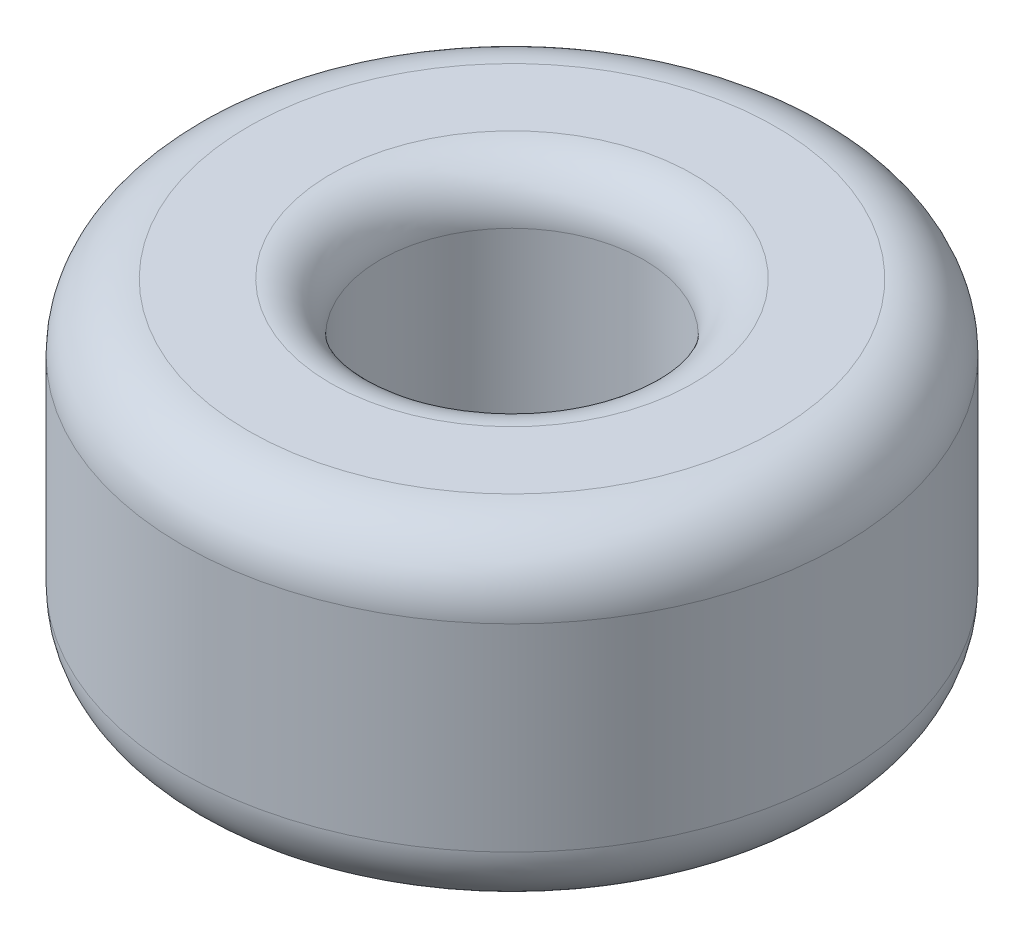
from build123d import *

# Parameters (mm, degrees)
CROQUIS1_R              = 50
CROQUIS1_R_2            = 20
SALIENTE_EXTRUIR3_DEPTH = 50
REDONDEO5_R             = 10
REDONDEO6_R             = 7.5


with BuildPart() as part:
    # Croquis1 → Saliente-Extruir3 (new body)
    with BuildSketch(Plane(origin=(0, 0, 0), x_dir=(1, 0, 0), z_dir=(0, 1, 0))):
        with Locations(Location((0, 0, 0), (0, 0, 270))):
            Circle(CROQUIS1_R)
        with Locations(Location((0, 0, 0), (0, 0, 270))):
            Circle(CROQUIS1_R_2, mode=Mode.SUBTRACT)
    extrude(amount=SALIENTE_EXTRUIR3_DEPTH)

    # Redondeo5
    redondeo5_edges = [part.edges().sort_by_distance(p)[0] for p in [
        (0, 0, -50),
        (0, 50, -50),
    ]]
    fillet(redondeo5_edges, radius=REDONDEO5_R)

    # Redondeo6
    redondeo6_edges = [part.edges().sort_by_distance(p)[0] for p in [
        (0, 0, -20),
        (0, 50, -20),
    ]]
    fillet(redondeo6_edges, radius=REDONDEO6_R)


solid = part.part
